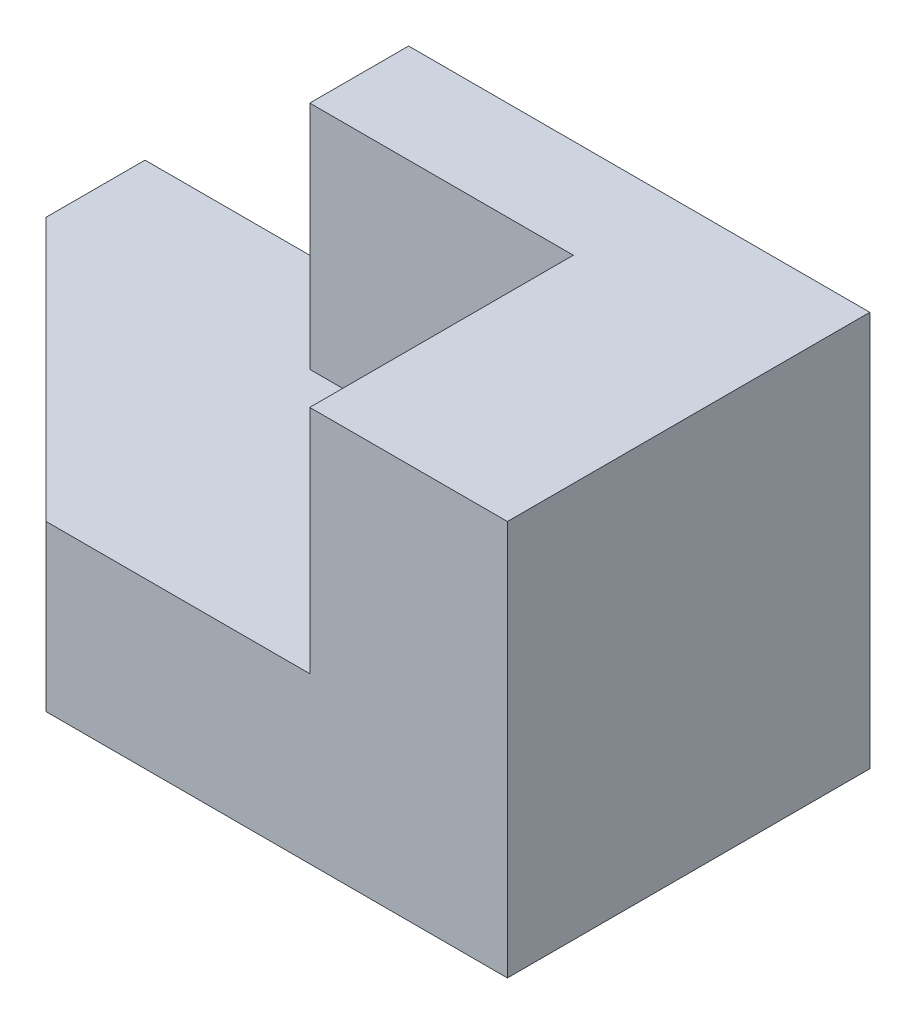
from build123d import *

# Parameters (mm, degrees)
BOSS_EXTRUDE1_DEPTH = 55
SKETCH2_W           = 40
SKETCH2_H           = 35
BOSS_EXTRUDE2_DEPTH = 15
BOSS_EXTRUDE3_DEPTH = 25


with BuildPart() as part:
    # Sketch1 → Boss-Extrude1 (new body)
    with BuildSketch(Plane.XY):
        Polygon((0, 0), (70, 0), (70, 60), (40, 60), (40, 25), (0, 25), align=None)
    extrude(amount=BOSS_EXTRUDE1_DEPTH)

    # Sketch2 → Boss-Extrude2 (add)
    with BuildSketch(Plane(origin=(0, 0, 0), x_dir=(-1, 0, 0), z_dir=(0, 0, -1))):
        with Locations((-20, 42.5)):
            Rectangle(SKETCH2_W, SKETCH2_H)
    extrude(amount=-BOSS_EXTRUDE2_DEPTH)

    # Sketch3 → Boss-Extrude3 (add)
    with BuildSketch(Plane(origin=(0, 25, 0), x_dir=(1, 0, 0), z_dir=(0, 1, 0))):
        Polygon((0, 0), (-40, 0), (-40, -15), (0, -55), align=None)
    extrude(amount=-BOSS_EXTRUDE3_DEPTH)


solid = part.part
